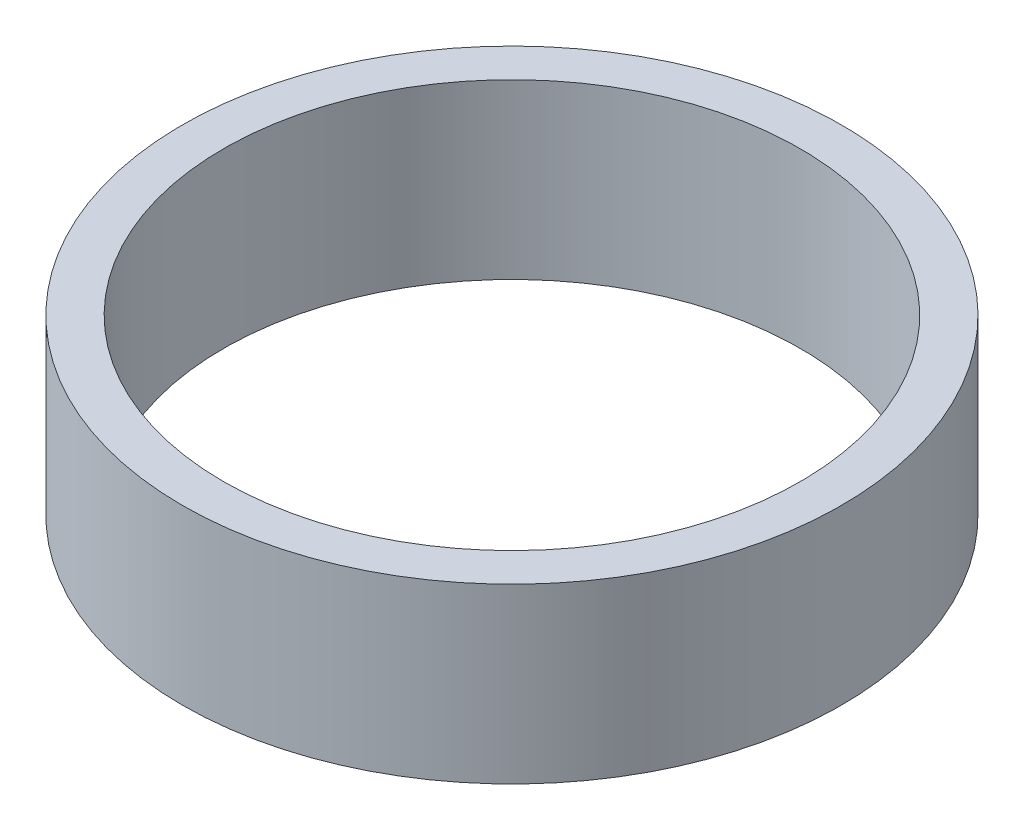
from build123d import *

# Parameters (mm, degrees)
SKETCH_1_R      = 40
SKETCH_1_R_2    = 35
EXTRUDE_1_DEPTH = 21


with BuildPart() as part:
    # Эскиз1 → Бобышка-Вытянуть1 (new body)
    with BuildSketch(Plane(origin=(0, 0, 0), x_dir=(1, 0, 0), z_dir=(0, 1, 0))):
        with Locations(Location((0, 0, 0), (0, 0, 270))):
            Circle(SKETCH_1_R)
        with Locations(Location((0, 0, 0), (0, 0, 270))):
            Circle(SKETCH_1_R_2, mode=Mode.SUBTRACT)
    extrude(amount=EXTRUDE_1_DEPTH)


solid = part.part
